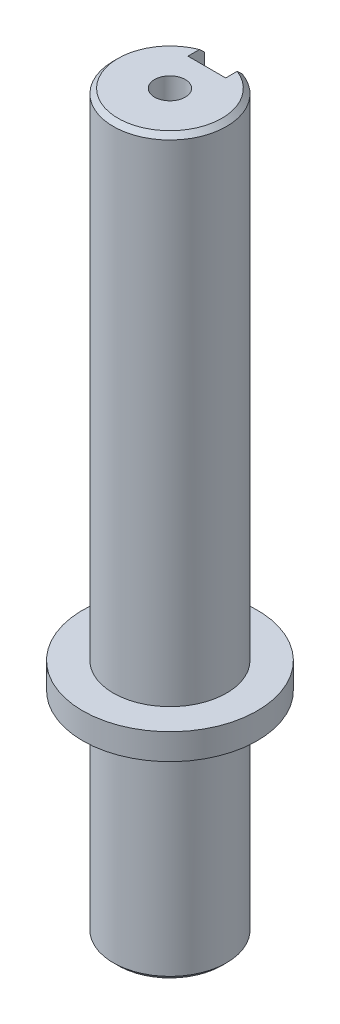
from build123d import *

# Parameters (mm, degrees)
SKETCH1_R                = 12
BOSS_EXTRUDE1_DEPTH      = 45
SKETCH2_R                = 18.5
BOSS_EXTRUDE2_DEPTH      = 5.5
SKETCH3_R                = 12
BOSS_EXTRUDE3_DEPTH      = 105
CUT_EXTRUDE1_DEPTH       = 42
BOSS_EXTRUDE4_REACH      = 160.792
BOSS_EXTRUDE4_END_RADIUS = 12
CUT_EXTRUDE2_START       = -102
CUT_EXTRUDE2_DEPTH       = 102
BOSS_EXTRUDE5_REACH      = 160.792
BOSS_EXTRUDE5_END_RADIUS = 12
SKETCH9_R                = 3.25
CUT_EXTRUDE3_DEPTH       = 30
CUT_EXTRUDE4_START       = -30
SKETCH10_R               = 3.25
CUT_EXTRUDE4_DEPTH       = 30
CHAMFER1_SIZE            = 1


with BuildPart() as part:
    # Sketch1 → Boss-Extrude1 (new body)
    with BuildSketch(Plane(origin=(0, 0, 0), x_dir=(1, 0, 0), z_dir=(0, 1, 0))):
        with Locations(Location((0, 0, 0), (0, 0, 90))):
            Circle(SKETCH1_R)
    extrude(amount=BOSS_EXTRUDE1_DEPTH)

    # Sketch2 → Boss-Extrude2 (add)
    with BuildSketch(Plane(origin=(0, 45, 0), x_dir=(1, 0, 0), z_dir=(0, 1, 0))):
        with Locations(Location((0, 0, 0), (0, 0, 270))):
            Circle(SKETCH2_R)
    extrude(amount=BOSS_EXTRUDE2_DEPTH)

    # Sketch3 → Boss-Extrude3 (add)
    with BuildSketch(Plane(origin=(0, 50.5, 0), x_dir=(1, 0, 0), z_dir=(0, 1, 0))):
        with Locations(Location((0, 0, 0), (0, 0, 90))):
            Circle(SKETCH3_R)
    extrude(amount=BOSS_EXTRUDE3_DEPTH)

    # Sketch4 → Cut-Extrude1 (cut)
    with BuildSketch(Plane.XZ):
        Polygon((-4, -12), (-4, -11.313708499), (-4, -7.813708499), (4, -7.813708499), (4, -12), align=None)
    extrude(amount=-CUT_EXTRUDE1_DEPTH, mode=Mode.SUBTRACT)

    # Boss-Extrude4: up to this cylinder (the profile starts inside it)
    boss_extrude4_end = Plane(origin=(0, 41.106528, 0), z_dir=(0, -1, 0)) * Cylinder(BOSS_EXTRUDE4_END_RADIUS, 346.584, mode=Mode.PRIVATE)
    # Sketch6 → Boss-Extrude4 (add, up to the surface)
    with BuildSketch(Plane(origin=(0, 0, -7.813708499), x_dir=(-1, 0, 0), z_dir=(0, 0, -1)), mode=Mode.PRIVATE) as boss_extrude4_sk1:
        with BuildLine():
            Line((-4, 42), (-4, 38))
            ThreePointArc((-4, 38), (-2.828427125, 40.828427125), (0, 42))
            Line((0, 42), (-4, 42))
        make_face()
    boss_extrude4_tool1 = extrude(boss_extrude4_sk1.sketch, amount=BOSS_EXTRUDE4_REACH, mode=Mode.PRIVATE) & boss_extrude4_end
    add(boss_extrude4_tool1.solids().sort_by_distance((3.106528, 41.106528, -7.813708))[0])
    # Sketch6 → Boss-Extrude4 (add, up to the surface)
    with BuildSketch(Plane(origin=(0, 0, -7.813708499), x_dir=(-1, 0, 0), z_dir=(0, 0, -1)), mode=Mode.PRIVATE) as boss_extrude4_sk2:
        with BuildLine():
            Line((4, 42), (0, 42))
            ThreePointArc((0, 42), (2.828427125, 40.828427125), (4, 38))
            Line((4, 38), (4, 42))
        make_face()
    boss_extrude4_tool2 = extrude(boss_extrude4_sk2.sketch, amount=BOSS_EXTRUDE4_REACH, mode=Mode.PRIVATE) & boss_extrude4_end
    add(boss_extrude4_tool2.solids().sort_by_distance((-3.106528, 41.106528, -7.813708))[0])

    # Sketch7 → Cut-Extrude2 (cut)
    with BuildSketch(Plane(origin=(0, 155.5, 0), x_dir=(1, 0, 0), z_dir=(0, 1, 0)).offset(CUT_EXTRUDE2_START)):
        with BuildLine():
            Line((4, 7.813708499), (4, 11.313708499))
            ThreePointArc((4, 11.313708499), (2.029223745, 11.827182716), (0, 12))
            ThreePointArc((0, 12), (-2.029223745, 11.827182716), (-4, 11.313708499))
            Line((-4, 11.313708499), (-4, 7.813708499))
            Line((-4, 7.813708499), (4, 7.813708499))
        make_face()
    extrude(amount=CUT_EXTRUDE2_DEPTH, mode=Mode.SUBTRACT)

    # Boss-Extrude5: up to this cylinder (the profile starts inside it)
    boss_extrude5_end = Plane(origin=(0, 54.393472, 0), z_dir=(0, -1, 0)) * Cylinder(BOSS_EXTRUDE5_END_RADIUS, 346.584, mode=Mode.PRIVATE)
    # Sketch8 → Boss-Extrude5 (add, up to the surface)
    with BuildSketch(Plane(origin=(0, 0, -7.813708499), x_dir=(-1, 0, 0), z_dir=(0, 0, -1)), mode=Mode.PRIVATE) as boss_extrude5_sk1:
        with BuildLine():
            Line((4, 53.5), (4, 57.5))
            ThreePointArc((4, 57.5), (2.828427125, 54.671572875), (0, 53.5))
            Line((0, 53.5), (4, 53.5))
        make_face()
    boss_extrude5_tool1 = extrude(boss_extrude5_sk1.sketch, amount=BOSS_EXTRUDE5_REACH, mode=Mode.PRIVATE) & boss_extrude5_end
    add(boss_extrude5_tool1.solids().sort_by_distance((-3.106528, 54.393472, -7.813708))[0])
    # Sketch8 → Boss-Extrude5 (add, up to the surface)
    with BuildSketch(Plane(origin=(0, 0, -7.813708499), x_dir=(-1, 0, 0), z_dir=(0, 0, -1)), mode=Mode.PRIVATE) as boss_extrude5_sk2:
        with BuildLine():
            Line((-4, 53.5), (0, 53.5))
            ThreePointArc((0, 53.5), (-2.828427125, 54.671572875), (-4, 57.5))
            Line((-4, 57.5), (-4, 53.5))
        make_face()
    boss_extrude5_tool2 = extrude(boss_extrude5_sk2.sketch, amount=BOSS_EXTRUDE5_REACH, mode=Mode.PRIVATE) & boss_extrude5_end
    add(boss_extrude5_tool2.solids().sort_by_distance((3.106528, 54.393472, -7.813708))[0])

    # Sketch9 → Cut-Extrude3 (cut)
    with BuildSketch(Plane.XZ):
        with Locations(Location((0, 0, 0), (0, 0, 270))):
            Circle(SKETCH9_R)
    extrude(amount=-CUT_EXTRUDE3_DEPTH, mode=Mode.SUBTRACT)

    # Sketch10 → Cut-Extrude4 (cut)
    with BuildSketch(Plane(origin=(0, 155.5, 0), x_dir=(1, 0, 0), z_dir=(0, 1, 0)).offset(CUT_EXTRUDE4_START)):
        with Locations(Location((0, 0, 0), (0, 0, 90))):
            Circle(SKETCH10_R)
    extrude(amount=CUT_EXTRUDE4_DEPTH, mode=Mode.SUBTRACT)

    # Chamfer1
    chamfer1_edges = [part.edges().sort_by_distance(p)[0] for p in [
        (0, 0, 12),
        (0, 155.5, 12),
    ]]
    chamfer(chamfer1_edges, length=CHAMFER1_SIZE)


solid = part.part
